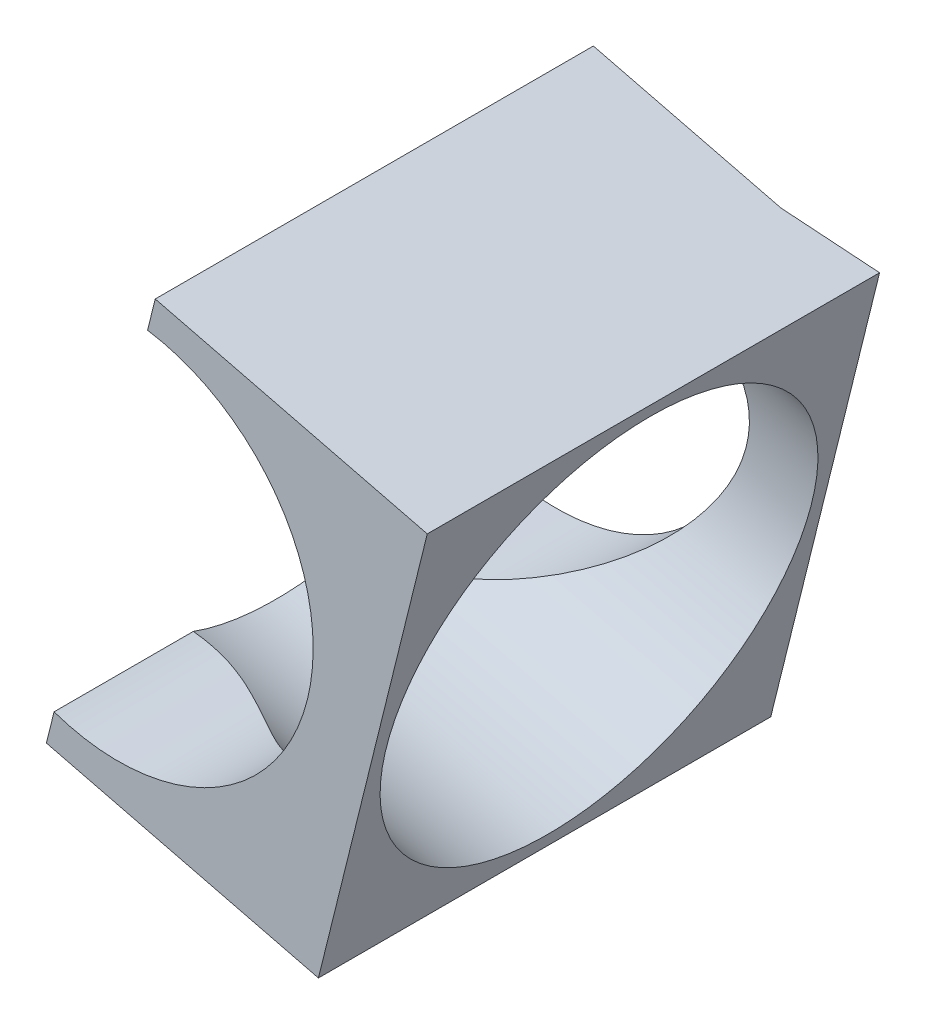
from build123d import *

# Parameters (mm, degrees)
RESSALTO_EXTRUS_O1_DEPTH = 25.5
CORTE_EXTRUS_O1_DEPTH    = 41.120836281
ESBO_O3_R                = 12
CORTE_EXTRUS_O2_DEPTH    = 38.197113334


with BuildPart() as part:
    # Esboço1 → Ressalto-extrusão1 (new body)
    with BuildSketch(Plane.XY):
        with BuildLine():
            Line((17.433095525, 13.814174971), (2.097319146, 17.616011747))
            Line((2.097319146, 17.616011747), (1.665269548, 15.873218352))
            ThreePointArc((1.665269548, 15.873218352), (10.676806339, 2.353151612), (-3.606507064, -5.391973191))
            Line((-3.606507064, -5.391973191), (-4.038556662, -7.134766585))
            Line((-4.038556662, -7.134766585), (11.297219716, -10.936603361))
            Line((11.297219716, -10.936603361), (17.433095525, 13.814174971))
        make_face()
    extrude(amount=-RESSALTO_EXTRUS_O1_DEPTH)

    # Esboço2 → Corte-extrusão1 (cut, through all)
    with BuildSketch(Plane(origin=(4.235701857, 17.085893034, 0), x_dir=(0, 0, 1), z_dir=(0.2406225807344443, 0.9706187581335403, 0))):
        Polygon((-24.7, -2.203112904), (-24.7, 8.696887096), (-25.5, 13.596887096), (-25.5, -2.203112904), align=None)
    extrude(amount=-CORTE_EXTRUS_O1_DEPTH, mode=Mode.SUBTRACT)

    # Esboço3 → Corte-extrusão2 (cut, through all)
    with BuildSketch(Plane(origin=(13.197393668, -3.271718063, 0), x_dir=(-0.24062258073444448, -0.9706187581335403, 0), z_dir=(0.9706187581335403, -0.24062258073444448, 0))):
        with Locations(Location((-4.853093791, 12.75, 0), (0, 0, 180))):
            Circle(ESBO_O3_R)
    extrude(amount=-CORTE_EXTRUS_O2_DEPTH, mode=Mode.SUBTRACT)


solid = part.part
